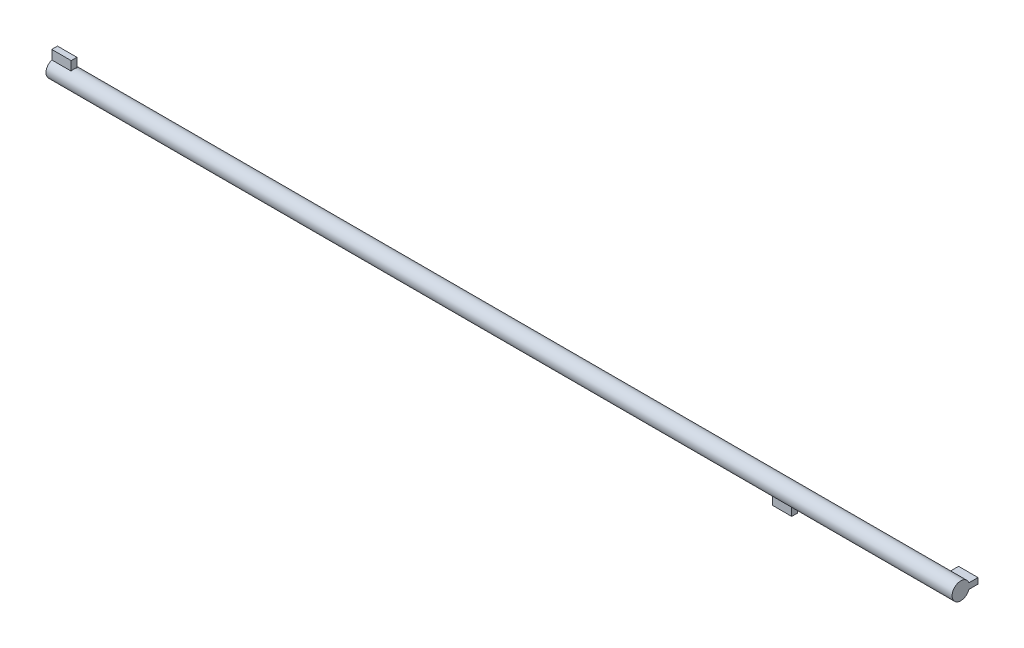
from build123d import *

# Parameters (mm, degrees)
SHAFT_DEPTH      = 43
SHAFT_DEPTH_BACK = 167
SKETCH1_R        = 2
SKETCH2_W        = 1.333333334
SKETCH2_H        = 4
SHAFT_M_DEPTH    = 4.5
SKETCH4_W        = 4
SKETCH4_H        = 1.333333334
SHAFT_R_DEPTH    = 4.5
SKETCH6_W        = 1.333333334
SKETCH6_H        = 4
SHAFT_L_DEPTH    = 4.5


with BuildPart() as part:
    # Sketch1 → Shaft (new, two sides: drawn at the far end of the back side and taken through both)
    with BuildSketch(Plane(origin=(0, 0, 0), x_dir=(0, 0, -1), z_dir=(1, 0, 0)).offset(-SHAFT_DEPTH_BACK)):
        Circle(SKETCH1_R)
    extrude(amount=SHAFT_DEPTH + SHAFT_DEPTH_BACK)

    # Sketch2 → Shaft M (add)
    with BuildSketch(Plane.ZY.offset(167)):
        with Locations((0, 2)):
            Rectangle(SKETCH2_W, SKETCH2_H)
    extrude(amount=-SHAFT_M_DEPTH)

    # Sketch4 → Shaft R (add)
    with BuildSketch(Plane(origin=(43, 0, 0), x_dir=(0, 0, -1), z_dir=(1, 0, 0))):
        with Locations((2, 0)):
            Rectangle(SKETCH4_W, SKETCH4_H)
    extrude(amount=-SHAFT_R_DEPTH)

    # Sketch6 → Shaft L (add)
    with BuildSketch(Plane(origin=(0, 0, 0), x_dir=(0, 0, -1), z_dir=(1, 0, 0))):
        with Locations((0, -2)):
            Rectangle(SKETCH6_W, SKETCH6_H)
    extrude(amount=SHAFT_L_DEPTH)


solid = part.part
